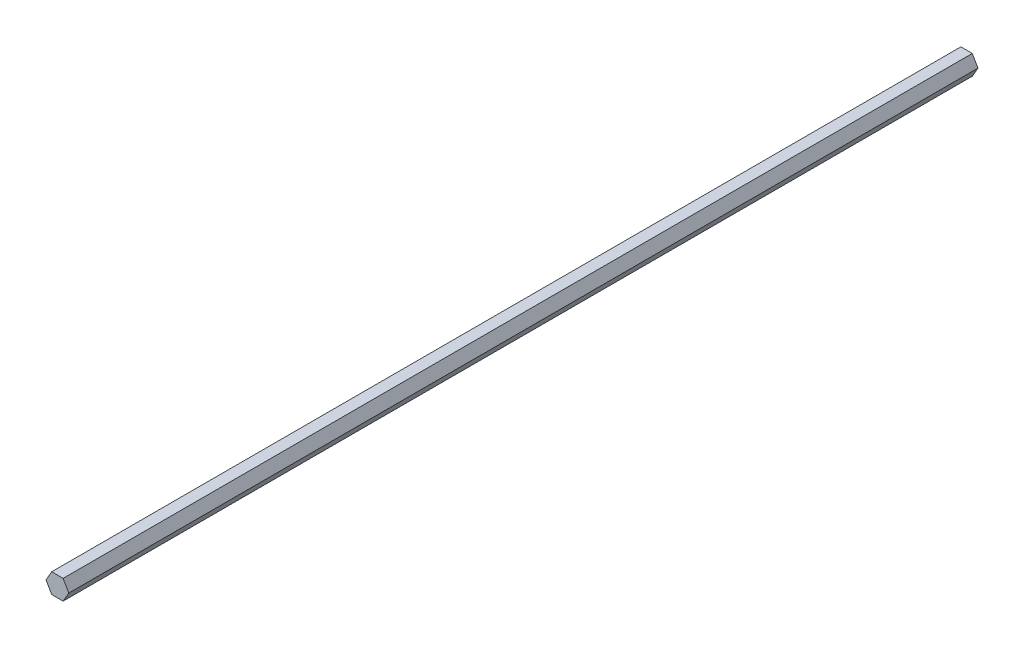
from build123d import *

# Parameters (mm, degrees)
BOSS_EXTRUDE1_DEPTH = 584.2


with BuildPart() as part:
    # Sketch1 → Boss-Extrude1 (new body)
    with BuildSketch(Plane.XY):
        Polygon((7.332348419, 0), (3.666174209, 6.35), (-3.666174209, 6.35), (-7.332348419, 0), (-3.666174209, -6.35), (3.666174209, -6.35), align=None)
    extrude(amount=BOSS_EXTRUDE1_DEPTH)


solid = part.part
